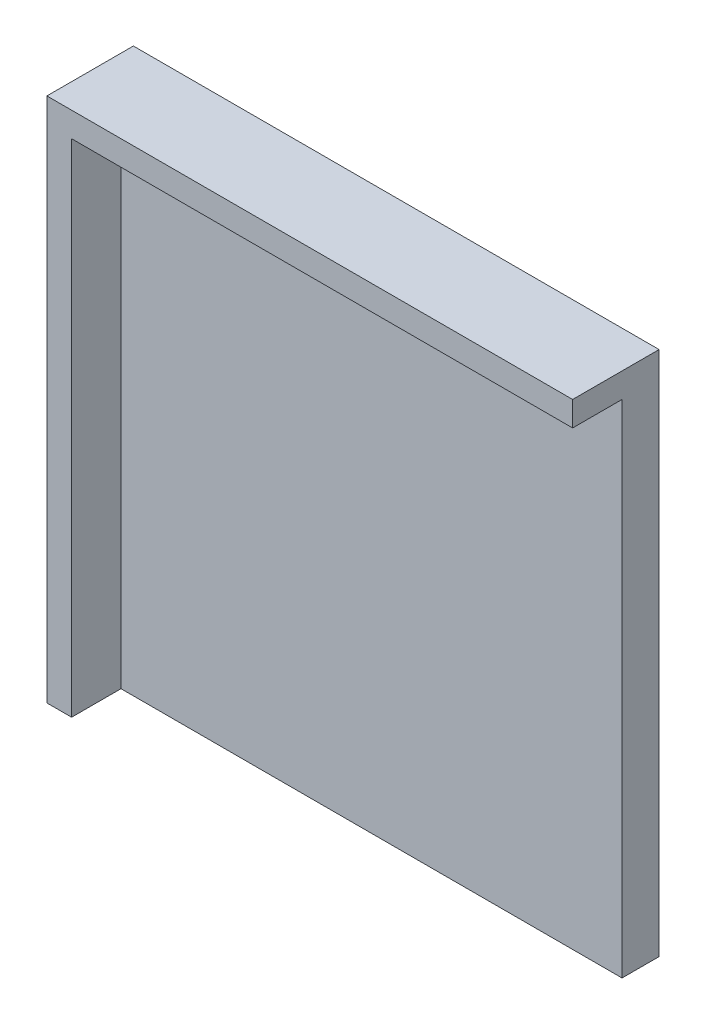
from build123d import *

# Parameters (mm, degrees)
SKETCH1_W           = 42.57
SKETCH1_H           = 42.57
BOSS_EXTRUDE1_DEPTH = 3
BOSS_EXTRUDE2_DEPTH = 4
SKETCH3_R           = 2.1
CUT_EXTRUDE1_DEPTH  = 2


with BuildPart() as part:
    # Sketch1 → Boss-Extrude1 (new body)
    with BuildSketch(Plane(origin=(0, 0, 0), x_dir=(0, 1, 0), z_dir=(0, 0, 1))):
        Rectangle(SKETCH1_W, SKETCH1_H)
    extrude(amount=BOSS_EXTRUDE1_DEPTH)

    # Sketch2 → Boss-Extrude2 (add)
    with BuildSketch(Plane.XY.offset(3)):
        Polygon((21.285, 21.285), (-21.285, 21.285), (-21.285, -21.285), (-19.285, -21.285), (-19.285, 19.285), (21.285, 19.285), align=None)
    extrude(amount=BOSS_EXTRUDE2_DEPTH)

    # Sketch3 → Cut-Extrude1 (cut)
    with BuildSketch(Plane(origin=(0, 0, 0), x_dir=(1, 0, 0), z_dir=(0, 0, -1))):
        with Locations(Location((-14.213932188, -14.213932188, 0), (0, 0, 180))):
            Circle(SKETCH3_R)
        with Locations(Location((14.213932188, 14.213932188, 0), (0, 0, 180))):
            Circle(SKETCH3_R)
    extrude(amount=-CUT_EXTRUDE1_DEPTH, mode=Mode.SUBTRACT)


solid = part.part
